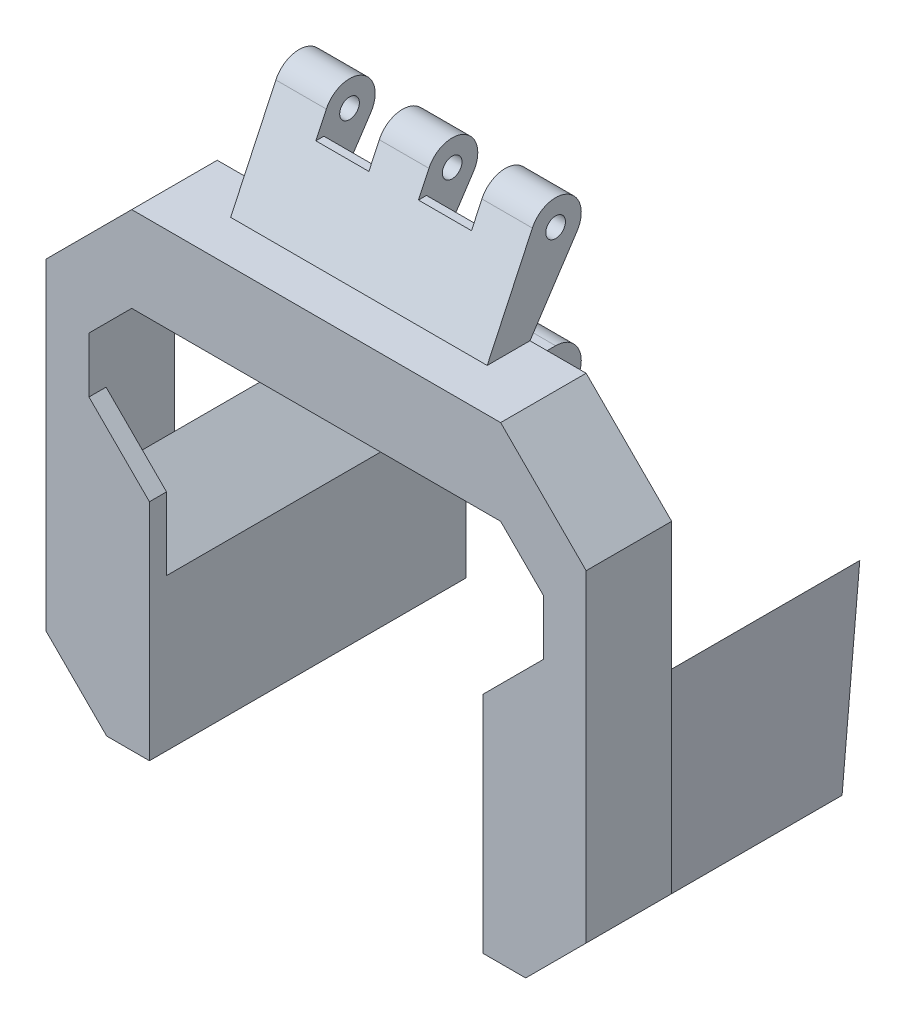
from build123d import *

# Parameters (mm, degrees)
EXTRUDE_1_DEPTH     = 25
EXTRUDE_2_DEPTH     = 2
CUT_EXTRUDE_1_DEPTH = 15
SKETCH_4_R          = 1.15
EXTRUDE_3_DEPTH     = 15
SKETCH_5_W          = 6.2
SKETCH_5_H          = 22
CUT_EXTRUDE_2_DEPTH = 74.581891949
SKETCH_6_W          = 6.2
SKETCH_6_H          = 2
CUT_EXTRUDE_3_DEPTH = 74.581891949
EXTRUDE_4_DEPTH     = 12
EXTRUDE_5_DEPTH     = 12


with BuildPart() as part:
    # 草图1 → 凸台-拉伸1 (new body)
    with BuildSketch(Plane.XY):
        Polygon((19.5, 14.714466094), (19.5, -3.035533906), (24.5, -3.035533906), (31.571067812, 4.035533906), (31.571067812, 41.75), (21.571067812, 51.75), (-21.571067812, 51.75), (-31.571067812, 41.75), (-31.571067812, 4.035533906), (-24.5, -3.035533906), (-19.5, -3.035533906), (-19.5, 14.714466094), (-26.571067812, 21.785533906), (-26.571067812, 36.75), (-21.571067812, 41.75), (21.571067812, 41.75), (26.571067812, 36.75), (26.571067812, 21.785533906), align=None)
    extrude(amount=EXTRUDE_1_DEPTH)

    # 草图2 → 凸台-拉伸2 (add)
    with BuildSketch(Plane.XY.offset(25)):
        Polygon((-26.571067812, 30.27081528), (-19.5, 23.199747468), (-19.5, 14.714466094), (-26.571067812, 21.785533906), align=None)
        Polygon((26.571067812, 30.27081528), (19.5, 23.199747468), (19.5, 14.714466094), (26.571067812, 21.785533906), align=None)
    extrude(amount=-EXTRUDE_2_DEPTH)

    # 草图3 → 切除-拉伸1 (cut)
    with BuildSketch(Plane(origin=(0, 0, 0), x_dir=(-1, 0, 0), z_dir=(0, 0, -1))):
        Polygon((26.571067812, 21.785533906), (24.5, -3.035533906), (31.571067812, 4.035533906), (31.571067812, 41.75), (21.571067812, 51.75), (-21.571067812, 51.75), (-31.571067812, 41.75), (-31.571067812, 4.035533906), (-24.5, -3.035533906), (-26.571067812, 21.785533906), (-26.571067812, 36.75), (-21.571067812, 41.75), (21.571067812, 41.75), (26.571067812, 36.75), align=None)
    extrude(amount=-CUT_EXTRUDE_1_DEPTH, mode=Mode.SUBTRACT)

    # 草图4 → 凸台-拉伸3 (add, symmetric)
    # profile 1 of 2: a face of its own
    with BuildSketch(Plane(origin=(0, 0, 0), x_dir=(0, 0, -1), z_dir=(1, 0, 0))):
        with BuildLine():
            Line((-12, 49.75), (-15, 49.75))
            ThreePointArc((-15, 49.75), (-18, 46.75), (-15, 43.75))
            Line((-15, 43.75), (-12, 43.75))
            ThreePointArc((-12, 43.75), (-9, 46.75), (-12, 49.75))
        make_face()
        with Locations((-12, 46.75)):
            Circle(SKETCH_4_R, mode=Mode.SUBTRACT)
    # profile 2 of 2: a face of its own
    with BuildSketch(Plane(origin=(0, 0, 0), x_dir=(0, 0, -1), z_dir=(1, 0, 0))):
        with BuildLine():
            Line((-14.716445048, 63.023156039), (-20, 51.75))
            Line((-20, 51.75), (-15, 51.75))
            Line((-15, 51.75), (-9.495412844, 60.098623853))
            ThreePointArc((-9.495412844, 60.098623853), (-10.533902095, 64.36735686), (-14.716445048, 63.023156039))
        make_face()
        with Locations((-12, 61.75)):
            Circle(SKETCH_4_R, mode=Mode.SUBTRACT)
    extrude(amount=EXTRUDE_3_DEPTH, both=True)

    # 草图5 → 切除-拉伸2 (cut, through all)
    with BuildSketch(Plane(origin=(0, 0, 15), x_dir=(-1, 0, 0), z_dir=(0, 0, -1))):
        with Locations((-6, 54.75)):
            Rectangle(SKETCH_5_W, SKETCH_5_H)
        with Locations((6, 54.75)):
            Rectangle(SKETCH_5_W, SKETCH_5_H)
    extrude(amount=CUT_EXTRUDE_2_DEPTH, mode=Mode.SUBTRACT)

    # 草图6 → 切除-拉伸3 (cut, through all)
    with BuildSketch(Plane(origin=(0, 0, 15), x_dir=(-1, 0, 0), z_dir=(0, 0, -1))):
        with Locations((-6, 61.418154436)):
            Rectangle(SKETCH_6_W, SKETCH_6_H)
        with Locations((6, 61.418154436)):
            Rectangle(SKETCH_6_W, SKETCH_6_H)
    extrude(amount=-CUT_EXTRUDE_3_DEPTH, mode=Mode.SUBTRACT)

    # 草图7 → 凸台-拉伸4 (add)
    with BuildSketch(Plane(origin=(0, 0, 0), x_dir=(-1, 0, 0), z_dir=(0, 0, -1))):
        Polygon((-26.571067812, 21.785533906), (-24.5, -3.035533906), (-19.5, -3.035533906), (-19.5, 14.714466094), align=None)
    extrude(amount=EXTRUDE_4_DEPTH)

    # 草图8 → 凸台-拉伸5 (add)
    with BuildSketch(Plane(origin=(0, 0, 0), x_dir=(-1, 0, 0), z_dir=(0, 0, -1))):
        Polygon((19.5, -3.035533906), (24.5, -3.035533906), (26.571067812, 21.785533906), (19.5, 14.714466094), align=None)
    extrude(amount=EXTRUDE_5_DEPTH)


solid = part.part
